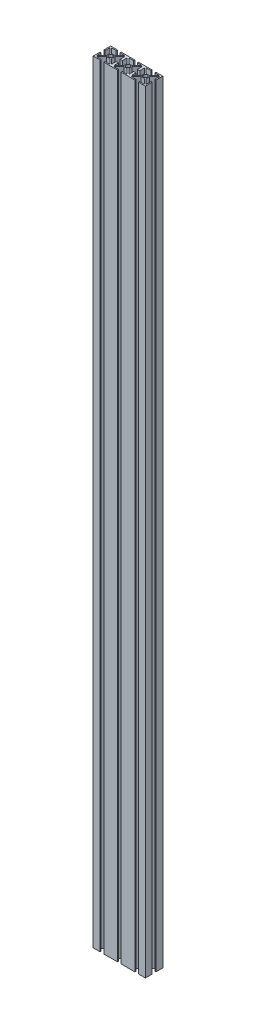
from build123d import *

# Parameters (mm, degrees)
SKETCH3_R           = 5
BOSS_EXTRUDE1_DEPTH = 2000


with BuildPart() as part:
    # Sketch3 → Boss-Extrude1 (new body)
    # profile 1 of 3: a face of its own
    with BuildSketch(Plane(origin=(0, 0, 0), x_dir=(1, 0, 0), z_dir=(0, 1, 0))):
        Polygon((-85.621320344, 6.5), (-72.621320344, 19.5), (-85, 19.5), (-85, 22.5), (-67.5, 22.5), (-67.5, 5), (-70.5, 5), (-70.5, 17.378679656), (-83.5, 4.378679656), (-83.5, -4.378679656), (-70.5, -17.378679656), (-70.5, -5), (-67.5, -5), (-67.5, -22.5), (-85, -22.5), (-85, -19.5), (-72.621320344, -19.5), (-85.621320344, -6.5), (-94.378679656, -6.5), (-107.378679656, -19.5), (-95, -19.5), (-95, -22.5), (-112.5, -22.5), (-112.5, -5), (-109.5, -5), (-109.5, -17.378679656), (-96.5, -4.378679656), (-96.5, 4.378679656), (-109.5, 17.378679656), (-109.5, 5), (-112.5, 5), (-112.5, 22.5), (-95, 22.5), (-95, 19.5), (-107.378679656, 19.5), (-94.378679656, 6.5), align=None)
        with Locations(Location((-90, 0, 0), (0, 0, 270))):
            Circle(SKETCH3_R, mode=Mode.SUBTRACT)
    # profile 2 of 3: a face of its own
    with BuildSketch(Plane(origin=(0, 0, 0), x_dir=(1, 0, 0), z_dir=(0, 1, 0))):
        Polygon((-40.621320344, 6.5), (-27.621320344, 19.5), (-40, 19.5), (-40, 22.5), (-22.5, 22.5), (-22.5, 5), (-25.5, 5), (-25.5, 17.378679656), (-38.5, 4.378679656), (-38.5, -4.378679656), (-25.5, -17.378679656), (-25.5, -5), (-22.5, -5), (-22.5, -22.5), (-40, -22.5), (-40, -19.5), (-27.621320344, -19.5), (-40.621320344, -6.5), (-49.378679656, -6.5), (-62.378679656, -19.5), (-50, -19.5), (-50, -22.5), (-67.5, -22.5), (-67.5, -5), (-64.5, -5), (-64.5, -17.378679656), (-51.5, -4.378679656), (-51.5, 4.378679656), (-64.5, 17.378679656), (-64.5, 5), (-67.5, 5), (-67.5, 22.5), (-50, 22.5), (-50, 19.5), (-62.378679656, 19.5), (-49.378679656, 6.5), align=None)
        with Locations(Location((-45, 0, 0), (0, 0, 270))):
            Circle(SKETCH3_R, mode=Mode.SUBTRACT)
    # profile 3 of 3: a face of its own
    with BuildSketch(Plane(origin=(0, 0, 0), x_dir=(1, 0, 0), z_dir=(0, 1, 0))):
        Polygon((6.5, -4.378679656), (19.5, -17.378679656), (19.5, -5), (22.5, -5), (22.5, -22.5), (5, -22.5), (5, -19.5), (17.378679656, -19.5), (4.378679656, -6.5), (-4.378679656, -6.5), (-17.378679656, -19.5), (-5, -19.5), (-5, -22.5), (-22.5, -22.5), (-22.5, -5), (-19.5, -5), (-19.5, -17.378679656), (-6.5, -4.378679656), (-6.5, 4.378679656), (-19.5, 17.378679656), (-19.5, 5), (-22.5, 5), (-22.5, 22.5), (-5, 22.5), (-5, 19.5), (-17.378679656, 19.5), (-4.378679656, 6.5), (4.378679656, 6.5), (17.378679656, 19.5), (5, 19.5), (5, 22.5), (22.5, 22.5), (22.5, 5), (19.5, 5), (19.5, 17.378679656), (6.5, 4.378679656), align=None)
        with Locations(Location((0, 0, 0), (0, 0, 270))):
            Circle(SKETCH3_R, mode=Mode.SUBTRACT)
    extrude(amount=BOSS_EXTRUDE1_DEPTH)


solid = part.part
